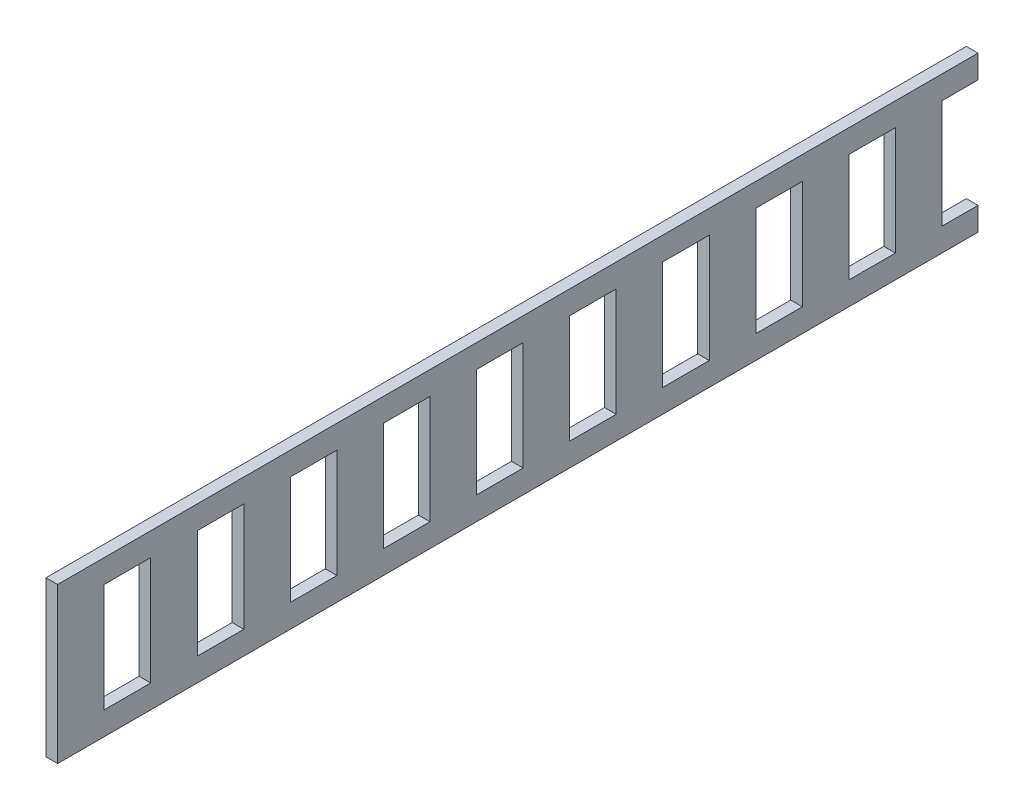
from build123d import *

# Parameters (mm, degrees)
SKETCH1_W           = 60
SKETCH1_H           = 140
BOSS_EXTRUDE1_DEPTH = 15


with BuildPart() as part:
    # Sketch1 → Boss-Extrude1 (new body)
    with BuildSketch(Plane(origin=(0, 0, 0), x_dir=(0, 0, -1), z_dir=(1, 0, 0))):
        Polygon((-593.2, 0), (593.2, 0), (593.2, 30), (546.8, 30), (546.8, 170), (593.2, 170), (593.2, 200), (-593.2, 200), align=None)
        with Locations((-503.2, 100)):
            Rectangle(SKETCH1_W, SKETCH1_H, mode=Mode.SUBTRACT)
        with Locations((-383.2, 100)):
            Rectangle(SKETCH1_W, SKETCH1_H, mode=Mode.SUBTRACT)
        with Locations((-263.2, 100)):
            Rectangle(SKETCH1_W, SKETCH1_H, mode=Mode.SUBTRACT)
        with Locations((-143.2, 100)):
            Rectangle(SKETCH1_W, SKETCH1_H, mode=Mode.SUBTRACT)
        with Locations((-23.2, 100)):
            Rectangle(SKETCH1_W, SKETCH1_H, mode=Mode.SUBTRACT)
        with Locations((96.8, 100)):
            Rectangle(SKETCH1_W, SKETCH1_H, mode=Mode.SUBTRACT)
        with Locations((216.8, 100)):
            Rectangle(SKETCH1_W, SKETCH1_H, mode=Mode.SUBTRACT)
        with Locations((336.8, 100)):
            Rectangle(SKETCH1_W, SKETCH1_H, mode=Mode.SUBTRACT)
        with Locations((456.8, 100)):
            Rectangle(SKETCH1_W, SKETCH1_H, mode=Mode.SUBTRACT)
    extrude(amount=BOSS_EXTRUDE1_DEPTH)


solid = part.part
